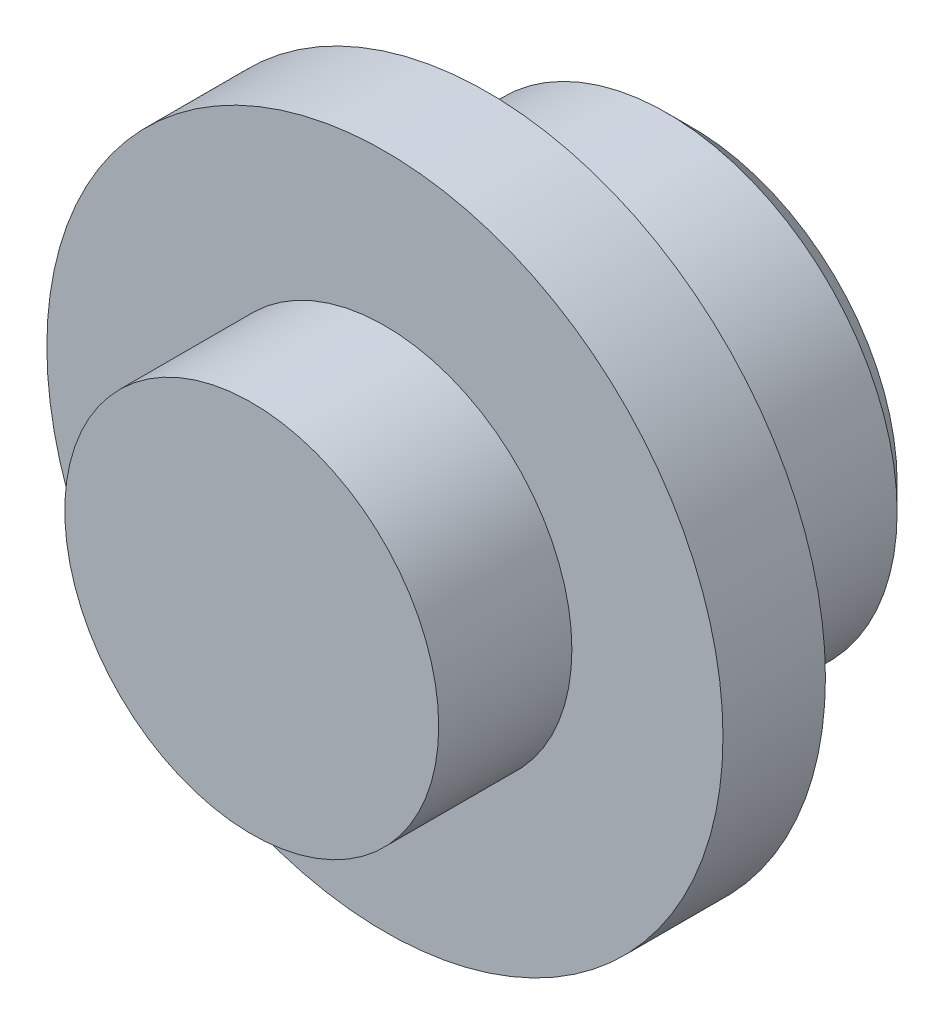
from build123d import *

# Parameters (mm, degrees)
SKETCH1_R           = 3.3
BOSS_EXTRUDE2_DEPTH = 1
SKETCH4_R           = 2.25
BOSS_EXTRUDE3_DEPTH = 2
CHAMFER4_SIZE       = 0.25
SKETCH5_R           = 1.825
BOSS_EXTRUDE4_DEPTH = 1.3


with BuildPart() as part:
    # Sketch1 → Boss-Extrude2 (new body)
    with BuildSketch(Plane.XY):
        with Locations((-126.049999999, -3.05)):
            Circle(SKETCH1_R)
    extrude(amount=-BOSS_EXTRUDE2_DEPTH)

    # Sketch4 → Boss-Extrude3 (add)
    with BuildSketch(Plane(origin=(0, 0, -1), x_dir=(-1, 0, 0), z_dir=(0, 0, -1))):
        with Locations((126.049999999, -3.05)):
            Circle(SKETCH4_R)
    extrude(amount=BOSS_EXTRUDE3_DEPTH)

    # Chamfer4
    chamfer4_edges = [part.edges().sort_by_distance(p)[0] for p in [
        (-123.799999999, -3.05, -3),
    ]]
    chamfer(chamfer4_edges, length=CHAMFER4_SIZE)

    # Sketch5 → Boss-Extrude4 (add)
    with BuildSketch(Plane.XY):
        with Locations((-126.049999999, -3.05)):
            Circle(SKETCH5_R)
    extrude(amount=BOSS_EXTRUDE4_DEPTH)


solid = part.part
